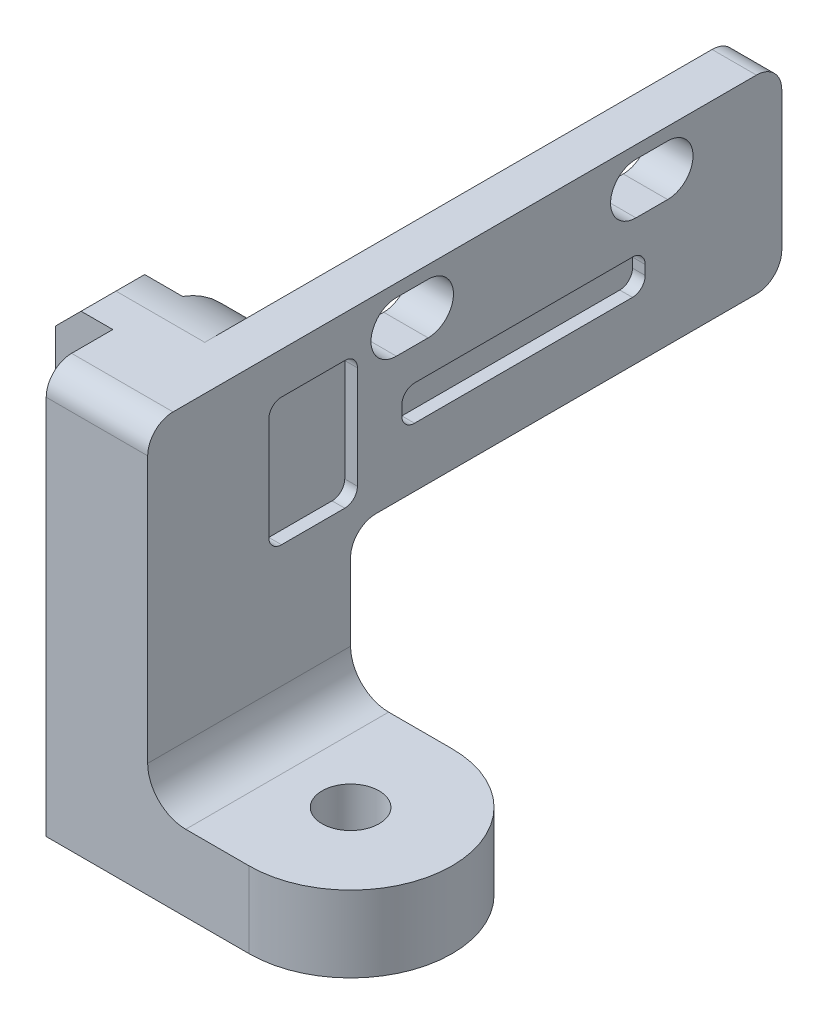
from build123d import *

# Parameters (mm, degrees)
BOSS_EXTRUDE1_DEPTH = 8
SKETCH2_W           = 5.5
SKETCH2_H           = 32
BOSS_EXTRUDE2_DEPTH = 4.5
CUT_EXTRUDE2_DEPTH  = 1
SKETCH5_W           = 4.5
SKETCH5_H           = 34
CUT_EXTRUDE3_DEPTH  = 53.351043088
FILLET4_R           = 2
CHAMFER1_SIZE       = 2
SKETCH6_R           = 2.25
BOSS_EXTRUDE3_DEPTH = 6
FILLET5_R           = 8
FILLET6_R           = 3


with BuildPart() as part:
    # Sketch1 → Boss-Extrude1 (new body)
    with BuildSketch(Plane(origin=(0, 0, 0), x_dir=(0, 0, -1), z_dir=(1, 0, 0))):
        Polygon((-32.846556001, 14.959797641), (-32.846556001, -2.08853598), (-48.846556001, -2.08853598), (-48.846556001, 29.91146402), (1.153443999, 29.91146402), (1.153443999, 14.959797641), align=None)
        with BuildLine():
            Line((-29.23609438, 28.91146402), (-26.73609438, 28.91146402))
            ThreePointArc((-26.73609438, 28.91146402), (-24.73609438, 26.91146402), (-26.73609438, 24.91146402))
            Line((-26.73609438, 24.91146402), (-29.23609438, 24.91146402))
            ThreePointArc((-29.23609438, 24.91146402), (-31.23609438, 26.91146402), (-29.23609438, 28.91146402))
        make_face(mode=Mode.SUBTRACT)
        with BuildLine():
            Line((-10.346556001, 28.91146402), (-7.846556001, 28.91146402))
            ThreePointArc((-7.846556001, 28.91146402), (-5.846556001, 26.91146402), (-7.846556001, 24.91146402))
            Line((-7.846556001, 24.91146402), (-10.346556001, 24.91146402))
            ThreePointArc((-10.346556001, 24.91146402), (-12.346556001, 26.91146402), (-10.346556001, 28.91146402))
        make_face(mode=Mode.SUBTRACT)
    extrude(amount=BOSS_EXTRUDE1_DEPTH)

    # Sketch2 → Boss-Extrude2 (add)
    with BuildSketch(Plane.ZY):
        with Locations((40.846556001, 13.91146402)):
            Rectangle(SKETCH2_W, SKETCH2_H)
    extrude(amount=BOSS_EXTRUDE2_DEPTH)

    # Sketch4 → Cut-Extrude2 (cut)
    with BuildSketch(Plane(origin=(8, 0, 0), x_dir=(0, 0, -1), z_dir=(1, 0, 0))):
        with BuildLine():
            Line((-33.306145699, 26.647879309), (-38.295392652, 26.647879309))
            ThreePointArc((-38.295392652, 26.647879309), (-39.002499434, 26.354986091), (-39.295392652, 25.647879309))
            Line((-39.295392652, 25.647879309), (-39.295392652, 17.565584617))
            ThreePointArc((-39.295392652, 17.565584617), (-39.002499434, 16.858477836), (-38.295392652, 16.565584617))
            Line((-38.295392652, 16.565584617), (-33.306145699, 16.565584617))
            ThreePointArc((-33.306145699, 16.565584617), (-32.599038918, 16.858477836), (-32.306145699, 17.565584617))
            Line((-32.306145699, 17.565584617), (-32.306145699, 25.647879309))
            ThreePointArc((-32.306145699, 25.647879309), (-32.599038918, 26.354986091), (-33.306145699, 26.647879309))
        make_face()
        with BuildLine():
            Line((-27.806359761, 22.368339675), (-10.62033731, 22.368339675))
            ThreePointArc((-10.62033731, 22.368339675), (-9.913230529, 22.075446457), (-9.62033731, 21.368339675))
            Line((-9.62033731, 21.368339675), (-9.62033731, 20.617921417))
            ThreePointArc((-9.62033731, 20.617921417), (-9.913230529, 19.910814636), (-10.62033731, 19.617921417))
            Line((-10.62033731, 19.617921417), (-27.806359761, 19.617921417))
            ThreePointArc((-27.806359761, 19.617921417), (-28.513466542, 19.910814636), (-28.806359761, 20.617921417))
            Line((-28.806359761, 20.617921417), (-28.806359761, 21.368339675))
            ThreePointArc((-28.806359761, 21.368339675), (-28.513466542, 22.075446457), (-27.806359761, 22.368339675))
        make_face()
    extrude(amount=-CUT_EXTRUDE2_DEPTH, mode=Mode.SUBTRACT)

    # Sketch5 → Cut-Extrude3 (cut, through all)
    with BuildSketch(Plane.XZ.offset(-14.959797641)):
        with Locations((2.25, 15.846556001)):
            Rectangle(SKETCH5_W, SKETCH5_H)
    extrude(amount=-CUT_EXTRUDE3_DEPTH, mode=Mode.SUBTRACT)

    # Fillet4
    fillet4_edges = [part.edges().sort_by_distance(p)[0] for p in [
        (6.25, 29.91146402, -1.153443999),
        (6.25, 14.959797641, -1.153443999),
        (6.25, 14.959797641, 32.846556001),
        (4, 29.91146402, 48.846556001),
    ]]
    fillet(fillet4_edges, radius=FILLET4_R)

    # Chamfer1
    chamfer1_edges = [part.edges().sort_by_distance(p)[0] for p in [
        (-4.5, -2.08853598, 40.846556001),
        (-4.5, 29.91146402, 40.846556001),
    ]]
    chamfer(chamfer1_edges, length=CHAMFER1_SIZE)

    # Sketch6 → Boss-Extrude3 (add)
    with BuildSketch(Plane.XZ.offset(2.08853598)):
        with BuildLine():
            Line((8, 48.846556001), (16, 48.846556001))
            ThreePointArc((16, 48.846556001), (24, 40.846556001), (16, 32.846556001))
            Line((16, 32.846556001), (8, 32.846556001))
            Line((8, 32.846556001), (8, 48.846556001))
        make_face()
        with Locations(Location((16, 40.846556001, 0), (0, 0, 270))):
            Circle(SKETCH6_R, mode=Mode.SUBTRACT)
    extrude(amount=-BOSS_EXTRUDE3_DEPTH)

    # Fillet5
    fillet5_edges = [part.edges().sort_by_distance(p)[0] for p in [
        (2.25, 29.91146402, 32.846556001),
    ]]
    fillet(fillet5_edges, radius=FILLET5_R)

    # Fillet6
    fillet6_edges = [part.edges().sort_by_distance(p)[0] for p in [
        (8, 3.91146402, 40.846556001),
    ]]
    fillet(fillet6_edges, radius=FILLET6_R)


solid = part.part
